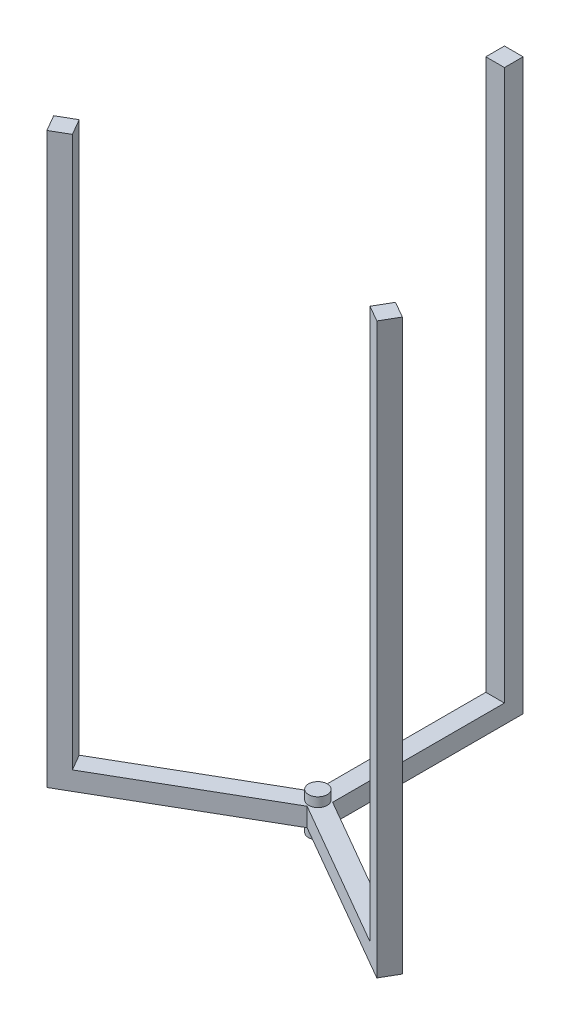
from build123d import *

# Parameters (mm, degrees)
ESQUISSE2_W                  = 2
ESQUISSE2_H                  = 2
ESQUISSE3_R                  = 1
BOSS_EXTRU_1_DEPTH           = 2
R_P_TITION_CIRCULAIRE1_COUNT = 3


with BuildPart() as part:
    # Balayage2: sweep along a curve in space
    with BuildLine() as balayage2_path:
        Line((0, 0, 0), (0, 0, -20))
        Line((0, 0, -20), (0, 60, -20))
    # Esquisse2 → Balayage2 (sweep)
    with BuildSketch(Plane.XY):
        Rectangle(ESQUISSE2_W, ESQUISSE2_H)
    balayage2 = sweep(path=balayage2_path.line, transition=Transition.RIGHT)

    # Esquisse3 → Boss.-Extru.1 (add, symmetric)
    with BuildSketch(Plane(origin=(0, 0, 0), x_dir=(1, 0, 0), z_dir=(0, 1, 0))):
        with Locations(Location((0, 0, 0), (0, 0, 270))):
            Circle(ESQUISSE3_R)
    extrude(amount=BOSS_EXTRU_1_DEPTH, both=True)

    # Répétition circulaire1: Balayage2 ×3 about axis
    r_p_tition_circulaire1_axis = Axis((0, 0, 0), (0, 1, 0))
    for i in range(1, R_P_TITION_CIRCULAIRE1_COUNT):
        add(balayage2.rotate(r_p_tition_circulaire1_axis, i * 360 / R_P_TITION_CIRCULAIRE1_COUNT))


solid = part.part
